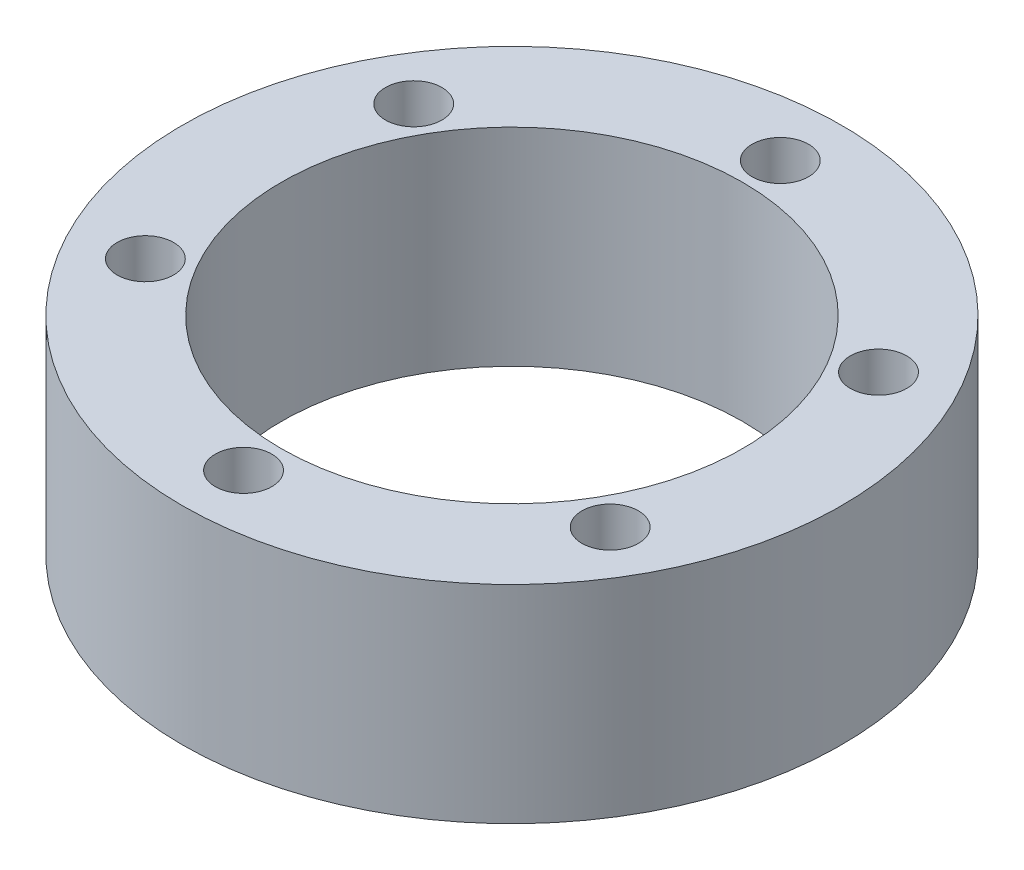
from build123d import *

# Parameters (mm, degrees)
SKETCH1_R           = 35
SKETCH1_R_2         = 24.5
SKETCH1_R_3         = 3
BOSS_EXTRUDE1_DEPTH = 22


with BuildPart() as part:
    # Sketch1 → Boss-Extrude1 (new body)
    with BuildSketch(Plane(origin=(0, 0, 0), x_dir=(1, 0, 0), z_dir=(0, 1, 0))):
        with Locations(Location((0, 0, 0), (0, 0, 270))):
            Circle(SKETCH1_R)
        with Locations(Location((0, 0, 0), (0, 0, 270))):
            Circle(SKETCH1_R_2, mode=Mode.SUBTRACT)
        with Locations(Location((0, 28.5, 0), (0, 0, 270))):
            Circle(SKETCH1_R_3, mode=Mode.SUBTRACT)
        with Locations(Location((24.681724008, 14.25, 0), (0, 0, 270))):
            Circle(SKETCH1_R_3, mode=Mode.SUBTRACT)
        with Locations(Location((24.681724008, -14.25, 0), (0, 0, 270))):
            Circle(SKETCH1_R_3, mode=Mode.SUBTRACT)
        with Locations(Location((0, -28.5, 0), (0, 0, 270))):
            Circle(SKETCH1_R_3, mode=Mode.SUBTRACT)
        with Locations(Location((-24.681724008, -14.25, 0), (0, 0, 270))):
            Circle(SKETCH1_R_3, mode=Mode.SUBTRACT)
        with Locations(Location((-24.681724008, 14.25, 0), (0, 0, 270))):
            Circle(SKETCH1_R_3, mode=Mode.SUBTRACT)
    extrude(amount=BOSS_EXTRUDE1_DEPTH)


solid = part.part
